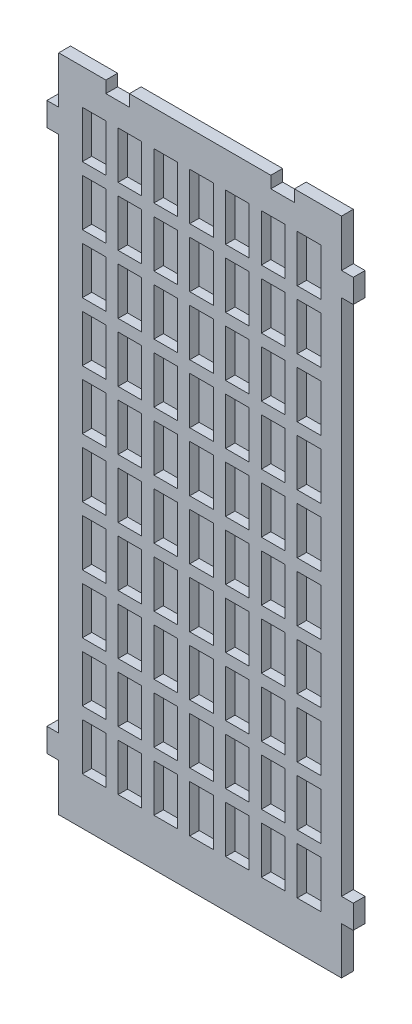
from build123d import *

# Parameters (mm, degrees)
BOSS_EXTRUDE1_DEPTH  = 3.175
SKETCH2_W            = 6.35
SKETCH2_H            = 12.7
CUT_EXTRUDE1_DEPTH   = 2.54
LPATTERN1_COUNT      = 7
LPATTERN1_PITCH      = 9.652
LPATTERN1_COUNT_DIR2 = 10
LPATTERN1_PITCH_DIR2 = 15.875


with BuildPart() as part:
    # Sketch1 → Boss-Extrude1 (new body)
    with BuildSketch(Plane.XY):
        Polygon((57.15, 0), (19.05, 0), (19.05, -3.175), (12.7, -3.175), (12.7, 0), (0, 0), (0, -12.7), (-3.175, -12.7), (-3.175, -19.05), (0, -19.05), (0, -158.75), (-3.175, -158.75), (-3.175, -165.1), (0, -165.1), (0, -177.8), (12.7, -177.8), (76.2, -177.8), (76.2, -165.1), (79.375, -165.1), (79.375, -158.75), (76.2, -158.75), (76.2, -19.05), (79.375, -19.05), (79.375, -12.7), (76.2, -12.7), (76.2, 0), (63.5, 0), (63.5, -3.175), (57.15, -3.175), align=None)
    extrude(amount=BOSS_EXTRUDE1_DEPTH)

    # Sketch2 → Cut-Extrude1 (cut)
    with BuildSketch(Plane.XY.offset(3.175)):
        with Locations((9.525, -15.875)):
            Rectangle(SKETCH2_W, SKETCH2_H)
    cut_extrude1 = extrude(amount=-CUT_EXTRUDE1_DEPTH, mode=Mode.SUBTRACT)

    # LPattern1: Cut-Extrude1 7 × 10
    with Locations(*[(i * LPATTERN1_PITCH, -j * LPATTERN1_PITCH_DIR2, 0) for i in range(LPATTERN1_COUNT) for j in range(LPATTERN1_COUNT_DIR2) if (i, j) != (0, 0)]):
        add(cut_extrude1, mode=Mode.SUBTRACT)


solid = part.part
